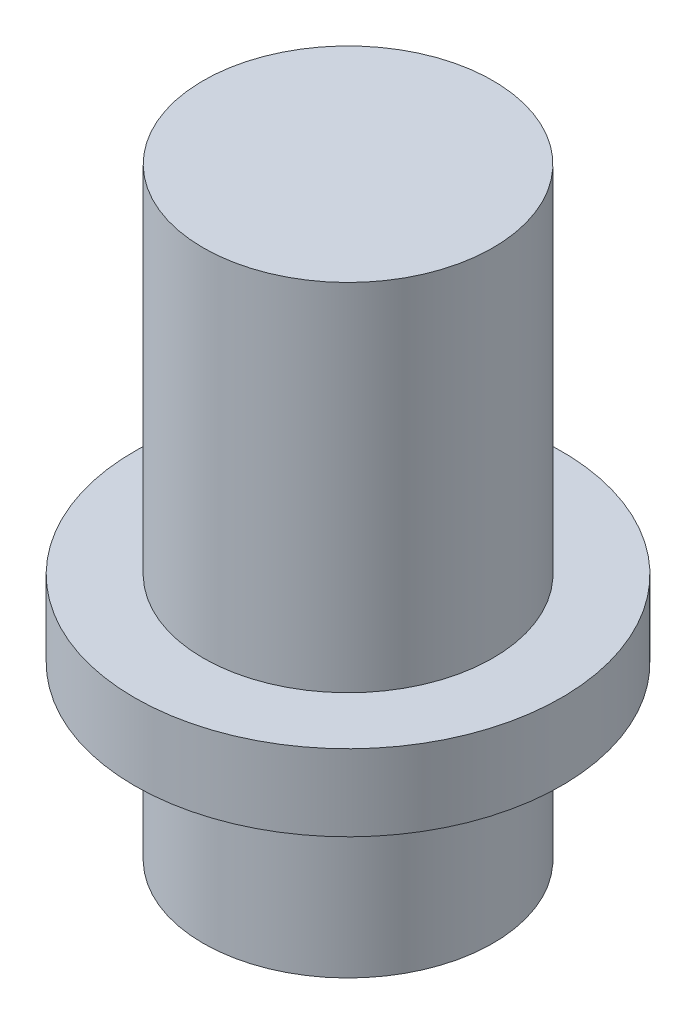
from build123d import *

# Parameters (mm, degrees)
SKETCH1_R           = 9.5
BOSS_EXTRUDE1_DEPTH = 11.2
SKETCH2_R           = 14
BOSS_EXTRUDE2_DEPTH = 5
SKETCH3_R           = 9.5
BOSS_EXTRUDE3_DEPTH = 23.3


with BuildPart() as part:
    # Sketch1 → Boss-Extrude1 (new body)
    with BuildSketch(Plane(origin=(0, 0, 0), x_dir=(1, 0, 0), z_dir=(0, 1, 0))):
        with Locations(Location((0, 0, 0), (0, 0, 270))):
            Circle(SKETCH1_R)
    extrude(amount=BOSS_EXTRUDE1_DEPTH)

    # Sketch2 → Boss-Extrude2 (add)
    with BuildSketch(Plane(origin=(0, 11.2, 0), x_dir=(1, 0, 0), z_dir=(0, 1, 0))):
        with Locations(Location((0, 0, 0), (0, 0, 270))):
            Circle(SKETCH2_R)
    extrude(amount=BOSS_EXTRUDE2_DEPTH)

    # Sketch3 → Boss-Extrude3 (add)
    with BuildSketch(Plane(origin=(0, 16.2, 0), x_dir=(1, 0, 0), z_dir=(0, 1, 0))):
        with Locations(Location((0, 0, 0), (0, 0, 270))):
            Circle(SKETCH3_R)
    extrude(amount=BOSS_EXTRUDE3_DEPTH)


solid = part.part
